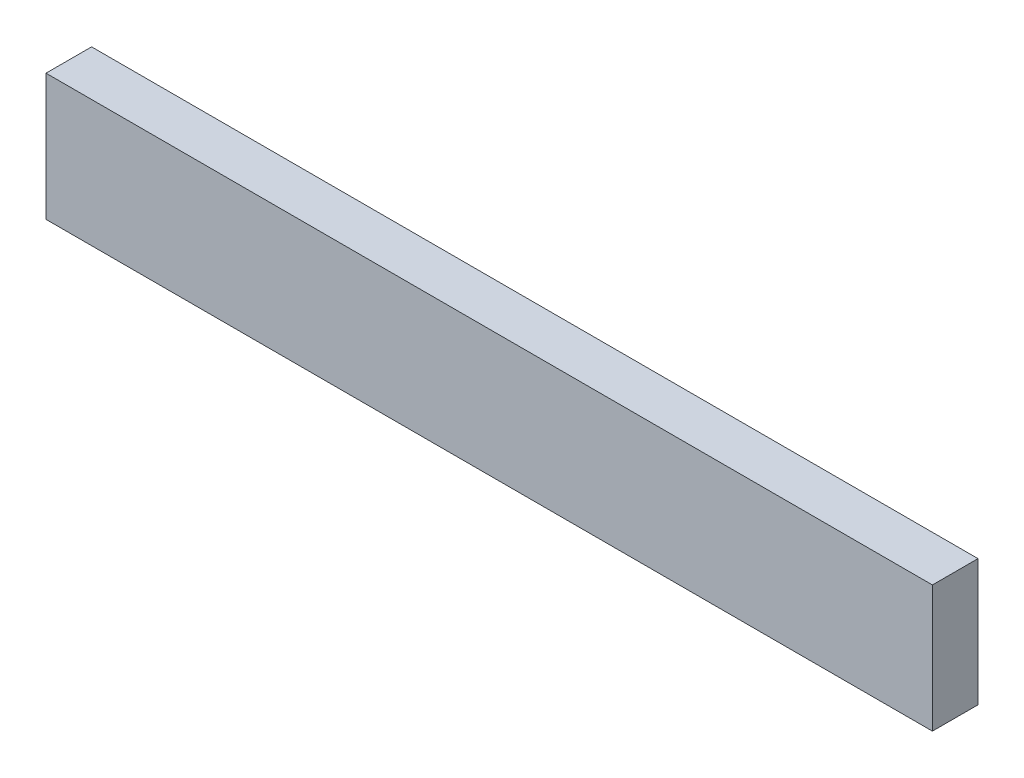
from build123d import *

# Parameters (mm, degrees)
SKETCH1_W           = 350
SKETCH1_H           = 50
BOSS_EXTRUDE1_DEPTH = 18


with BuildPart() as part:
    # Sketch1 → Boss-Extrude1 (new body)
    with BuildSketch(Plane.XY):
        with Locations((175, 25)):
            Rectangle(SKETCH1_W, SKETCH1_H)
    extrude(amount=BOSS_EXTRUDE1_DEPTH)


solid = part.part
